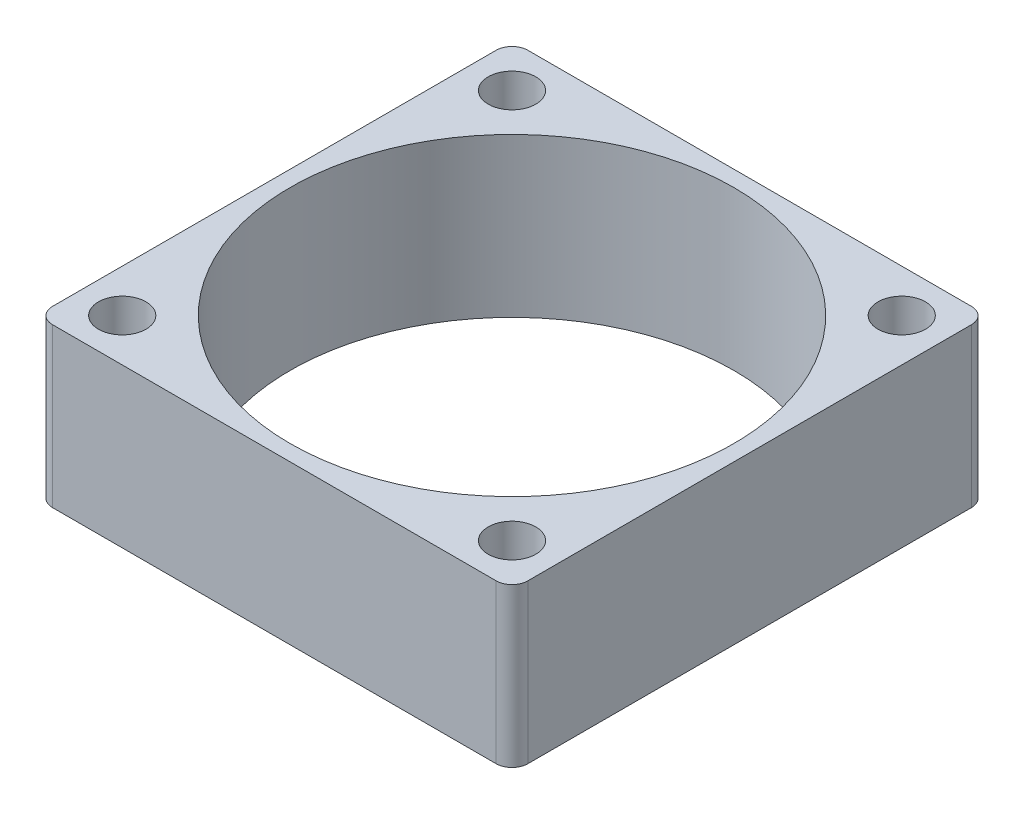
from build123d import *

# Parameters (mm, degrees)
SKETCH_1_W          = 30
SKETCH_1_H          = 30
EXTRUDE_1_DEPTH     = 10
SKETCH_2_R          = 1.5
CUT_EXTRUDE_1_DEPTH = 24.452078799
FILLET_1_R          = 1
SKETCH_3_R          = 14
CUT_EXTRUDE_2_DEPTH = 24.452078799


with BuildPart() as part:
    # 草图1 → 凸台-拉伸1 (new body)
    with BuildSketch(Plane(origin=(0, 0, 0), x_dir=(1, 0, 0), z_dir=(0, 1, 0))):
        Rectangle(SKETCH_1_W, SKETCH_1_H)
    extrude(amount=EXTRUDE_1_DEPTH)

    # 草图2 → 切除-拉伸1 (cut, through all)
    with BuildSketch(Plane(origin=(0, 10, 0), x_dir=(1, 0, 0), z_dir=(0, 1, 0))):
        with Locations(Location((-12.3, 12.3, 0), (0, 0, 270))):
            Circle(SKETCH_2_R)
        with Locations(Location((12.3, 12.3, 0), (0, 0, 270))):
            Circle(SKETCH_2_R)
        with Locations(Location((-12.3, -12.3, 0), (0, 0, 270))):
            Circle(SKETCH_2_R)
        with Locations(Location((12.3, -12.3, 0), (0, 0, 270))):
            Circle(SKETCH_2_R)
    extrude(amount=-CUT_EXTRUDE_1_DEPTH, mode=Mode.SUBTRACT)

    # 圆角1
    fillet_1_edges = [part.edges().sort_by_distance(p)[0] for p in [
        (15, 5, 15),
        (-15, 5, 15),
        (-15, 5, -15),
        (15, 5, -15),
    ]]
    fillet(fillet_1_edges, radius=FILLET_1_R)

    # 草图3 → 切除-拉伸2 (cut, through all)
    with BuildSketch(Plane(origin=(0, 10, 0), x_dir=(1, 0, 0), z_dir=(0, 1, 0))):
        with Locations(Location((0, 0, 0), (0, 0, 270))):
            Circle(SKETCH_3_R)
    extrude(amount=-CUT_EXTRUDE_2_DEPTH, mode=Mode.SUBTRACT)


solid = part.part
